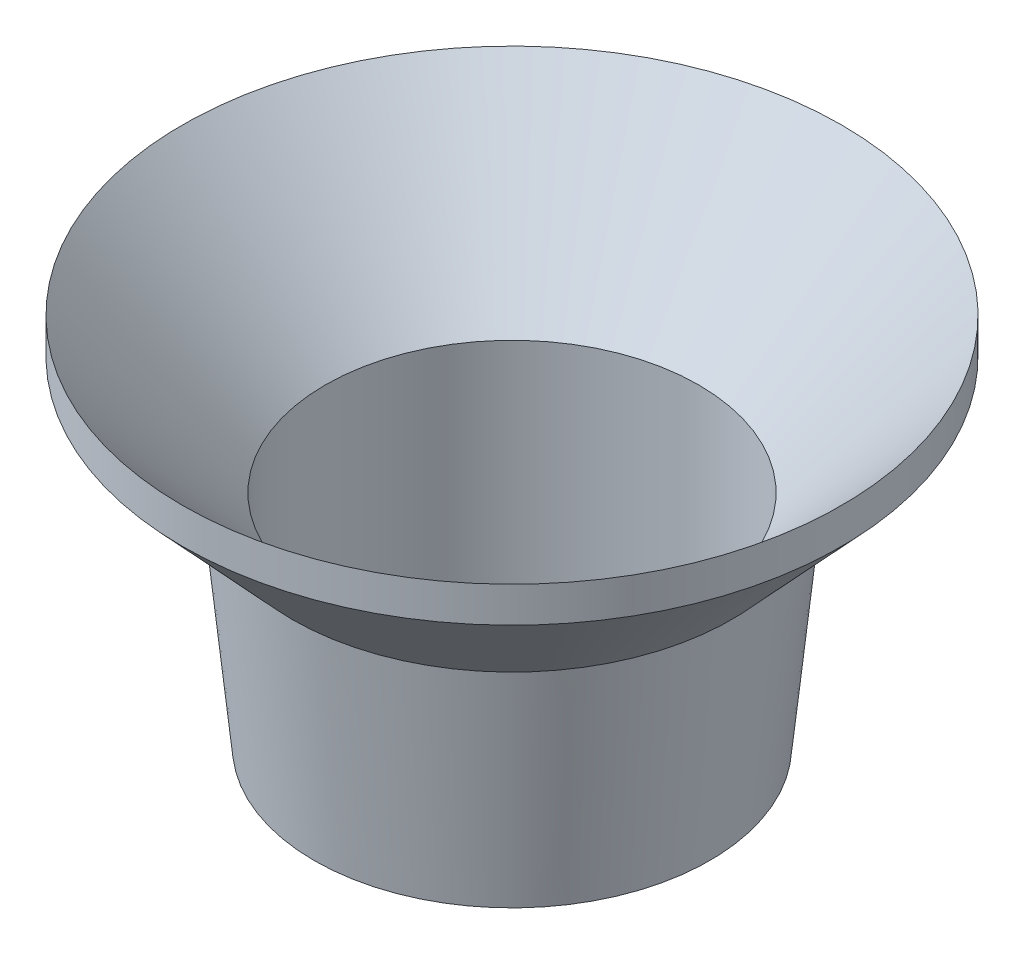
from build123d import *


with BuildPart() as part:
    # Sketch1 → Revolve1 (revolve)
    with BuildSketch(Plane(origin=(0, 0, 0), x_dir=(0, 0, -1), z_dir=(1, 0, 0))):
        Polygon((-15, 10.384615385), (-10, 5), (-9.001867305, -5), (-8.5, -5), (-8.5, 5), (-15, 12), align=None)
    revolve(axis=Axis((0, 20.775862069, 0), (0, -1, 0)))


solid = part.part
